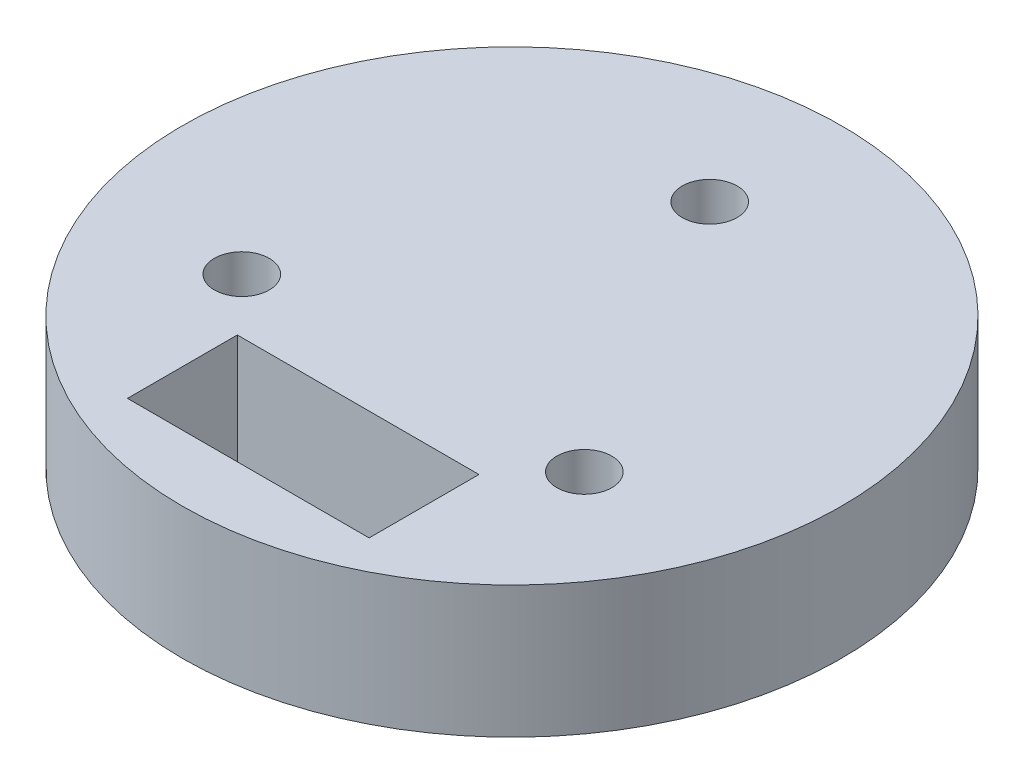
from build123d import *

# Parameters (mm, degrees)
SKETCH_1_R      = 15
SKETCH_1_R_2    = 1.25
SKETCH_1_W      = 11
SKETCH_1_H      = 5
EXTRUDE_1_DEPTH = 6


with BuildPart() as part:
    # 草图1 → 凸台-拉伸1 (new body)
    with BuildSketch(Plane(origin=(0, 0, 0), x_dir=(1, 0, 0), z_dir=(0, 1, 0))):
        with Locations(Location((0, 0, 0), (0, 0, 270))):
            Circle(SKETCH_1_R)
        with Locations(Location((0, 9, 0), (0, 0, 270))):
            Circle(SKETCH_1_R_2, mode=Mode.SUBTRACT)
        with Locations(Location((7.794228634, -4.5, 0), (0, 0, 270))):
            Circle(SKETCH_1_R_2, mode=Mode.SUBTRACT)
        with Locations(Location((-7.794228634, -4.5, 0), (0, 0, 270))):
            Circle(SKETCH_1_R_2, mode=Mode.SUBTRACT)
        with Locations((0, -9.5)):
            Rectangle(SKETCH_1_W, SKETCH_1_H, mode=Mode.SUBTRACT)
    extrude(amount=EXTRUDE_1_DEPTH)


solid = part.part
